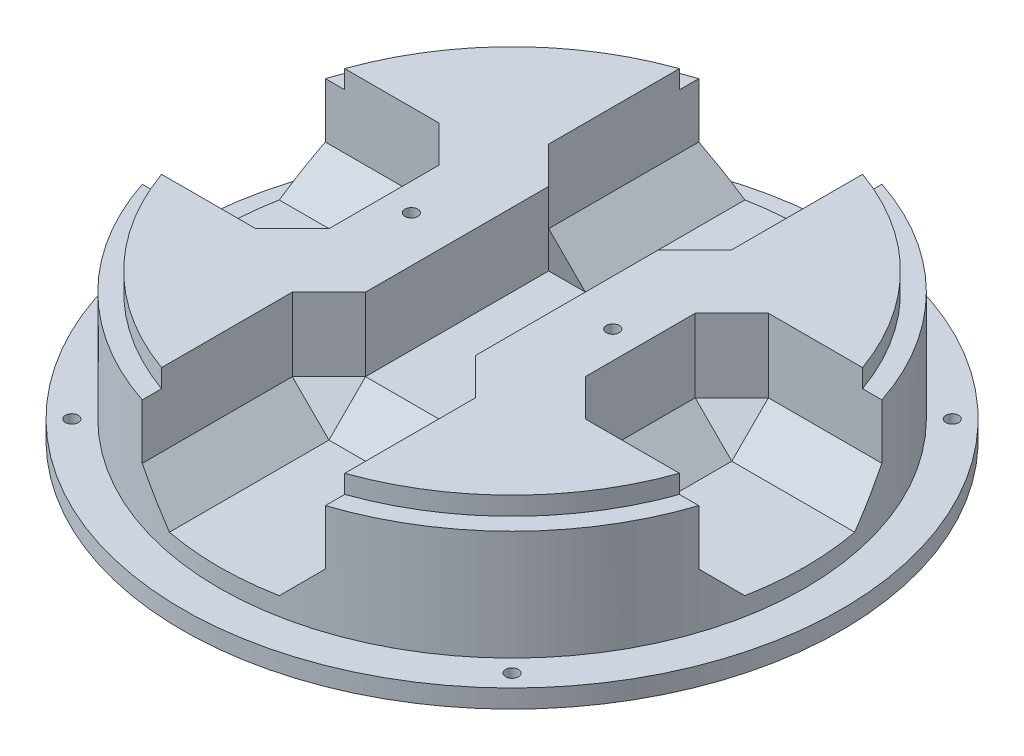
from build123d import *

# Parameters (mm, degrees)
SKETCH1_R                           = 80
BOSS_EXTRUDE1_DEPTH                 = 30
SKETCH2_R                           = 90
BOSS_EXTRUDE2_DEPTH                 = 5
SKETCH6_R                           = 75
BOSS_EXTRUDE3_DEPTH                 = 5
F_3_5_3_5_DIAMETER_HOLE1_D          = 3.5
F_3_5_3_5_DIAMETER_HOLE1_DEPTH      = 10
F_3_5_3_5_DIAMETER_HOLE1_TIP        = 1.051506083
SKETCH7_W                           = 50
SKETCH7_H                           = 110
CUT_EXTRUDE1_DEPTH                  = 30
CHAMFER1_SIZE                       = 10
SKETCH8_W                           = 30
SKETCH8_H                           = 50
CUT_EXTRUDE2_DEPTH                  = 20
F_3_5_3_5_DIAMETER_HOLE2_AT_2_COUNT = 2
F_3_5_3_5_DIAMETER_HOLE2_AT_2_PITCH = 85
F_3_5_3_5_DIAMETER_HOLE2_AT_3_COUNT = 2
F_3_5_3_5_DIAMETER_HOLE2_AT_3_PITCH = 85
F_3_5_3_5_DIAMETER_HOLE2_AT_4_COUNT = 2
F_3_5_3_5_DIAMETER_HOLE2_AT_4_PITCH = 85
F_3_5_3_5_DIAMETER_HOLE2_AT_5_COUNT = 2
F_3_5_3_5_DIAMETER_HOLE2_AT_5_PITCH = 85
SKETCH11_W                          = 80
SKETCH11_H                          = 50
CUT_EXTRUDE3_DEPTH                  = 30
CHAMFER2_SIZE                       = 10


with BuildPart() as part:
    # Sketch1 → Boss-Extrude1 (new body)
    with BuildSketch(Plane(origin=(0, 0, 0), x_dir=(1, 0, 0), z_dir=(0, 1, 0))):
        with Locations(Location((0, 0, 0), (0, 0, 270))):
            Circle(SKETCH1_R)
    extrude(amount=BOSS_EXTRUDE1_DEPTH)

    # Sketch2 → Boss-Extrude2 (add)
    with BuildSketch(Plane.XZ):
        with Locations(Location((0, 0, 0), (0, 0, 270))):
            Circle(SKETCH2_R)
    extrude(amount=BOSS_EXTRUDE2_DEPTH)

    # Sketch6 → Boss-Extrude3 (add)
    with BuildSketch(Plane(origin=(0, 30, 0), x_dir=(1, 0, 0), z_dir=(0, 1, 0))):
        with Locations(Location((0, 0, 0), (0, 0, 270))):
            Circle(SKETCH6_R)
    extrude(amount=BOSS_EXTRUDE3_DEPTH)

    # Ø3.5 (3.5) Diameter Hole1
    with Locations(Plane(origin=(-12.746034072, 35, -7.868896946), x_dir=(1, 0, 0), z_dir=(0, 1, 0))):
        with Locations((-14.753965928, -7.868896946), (40.246034072, -7.868896946)):
            Hole(F_3_5_3_5_DIAMETER_HOLE1_D / 2, depth=F_3_5_3_5_DIAMETER_HOLE1_DEPTH)
            with Locations((0, 0, -(F_3_5_3_5_DIAMETER_HOLE1_DEPTH + F_3_5_3_5_DIAMETER_HOLE1_TIP / 2))):  # 118° drill point
                Cone(0, F_3_5_3_5_DIAMETER_HOLE1_D / 2, F_3_5_3_5_DIAMETER_HOLE1_TIP, mode=Mode.SUBTRACT)

    # Sketch7 → Cut-Extrude1 (cut)
    with BuildSketch(Plane(origin=(0, 35, 0), x_dir=(1, 0, 0), z_dir=(0, 1, 0))):
        with Locations((0, 80)):
            Rectangle(SKETCH7_W, SKETCH7_H)
        with Locations((0, -80)):
            Rectangle(SKETCH7_W, SKETCH7_H)
    extrude(amount=-CUT_EXTRUDE1_DEPTH, mode=Mode.SUBTRACT)

    # Chamfer1
    chamfer1_edges = [part.edges().sort_by_distance(p)[0] for p in [
        (25, 5, -50.496710384),
        (-25, 5, -50.496710384),
        (-25, 20, -25),
        (0, 5, -25),
        (25, 20, -25),
        (25, 5, 50.496710384),
        (25, 20, 25),
        (-25, 5, 50.496710384),
        (0, 5, 25),
        (-25, 20, 25),
    ]]
    chamfer(chamfer1_edges, length=CHAMFER1_SIZE)

    # Sketch8 → Cut-Extrude2 (cut)
    with BuildSketch(Plane(origin=(0, 35, 0), x_dir=(1, 0, 0), z_dir=(0, 1, 0))):
        Rectangle(SKETCH8_W, SKETCH8_H)
    extrude(amount=-CUT_EXTRUDE2_DEPTH, mode=Mode.SUBTRACT)

    # Sketch9 → Ø3.5 (3.5) Diameter Hole2 (revolve, cut)
    with BuildSketch(Plane(origin=(0, 0, 0), x_dir=(0, 0, 1), z_dir=(1, 0, 0))):
        Polygon((0, 0), (0, 11.051506083), (1.75, 10), (1.75, 0), align=None)
    f_3_5_3_5_diameter_hole2 = revolve(axis=Axis((0, 6.35, 0), (0, -1, 0)), mode=Mode.SUBTRACT)

    # Ø3.5 (3.5) Diameter Hole2 at 2: Ø3.5 (3.5) Diameter Hole2 ×2
    with Locations(*[Vector(0.7071067811865478, 0, 0.7071067811865475) * (i * F_3_5_3_5_DIAMETER_HOLE2_AT_2_PITCH) for i in range(1, F_3_5_3_5_DIAMETER_HOLE2_AT_2_COUNT)]):
        add(f_3_5_3_5_diameter_hole2, mode=Mode.SUBTRACT)

    # Ø3.5 (3.5) Diameter Hole2 at 3: Ø3.5 (3.5) Diameter Hole2 ×2
    with Locations(*[Vector(-0.7071067811865477, 0, -0.7071067811865475) * (i * F_3_5_3_5_DIAMETER_HOLE2_AT_3_PITCH) for i in range(1, F_3_5_3_5_DIAMETER_HOLE2_AT_3_COUNT)]):
        add(f_3_5_3_5_diameter_hole2, mode=Mode.SUBTRACT)

    # Ø3.5 (3.5) Diameter Hole2 at 4: Ø3.5 (3.5) Diameter Hole2 ×2
    with Locations(*[Vector(-0.7071067811865476, 0, 0.7071067811865476) * (i * F_3_5_3_5_DIAMETER_HOLE2_AT_4_PITCH) for i in range(1, F_3_5_3_5_DIAMETER_HOLE2_AT_4_COUNT)]):
        add(f_3_5_3_5_diameter_hole2, mode=Mode.SUBTRACT)

    # Ø3.5 (3.5) Diameter Hole2 at 5: Ø3.5 (3.5) Diameter Hole2 ×2
    with Locations(*[Vector(0.7071067811865476, 0, -0.7071067811865476) * (i * F_3_5_3_5_DIAMETER_HOLE2_AT_5_PITCH) for i in range(1, F_3_5_3_5_DIAMETER_HOLE2_AT_5_COUNT)]):
        add(f_3_5_3_5_diameter_hole2, mode=Mode.SUBTRACT)

    # Sketch11 → Cut-Extrude3 (cut)
    with BuildSketch(Plane(origin=(0, 35, 0), x_dir=(1, 0, 0), z_dir=(0, 1, 0))):
        with Locations((75, 0)):
            Rectangle(SKETCH11_W, SKETCH11_H)
        with Locations((-75, 0)):
            Rectangle(SKETCH11_W, SKETCH11_H)
    extrude(amount=-CUT_EXTRUDE3_DEPTH, mode=Mode.SUBTRACT)

    # Chamfer2
    chamfer2_edges = [part.edges().sort_by_distance(p)[0] for p in [
        (55.496710384, 5, -25),
        (35, 20, -25),
        (55.496710384, 5, 25),
        (35, 5, 0),
        (35, 20, 25),
        (-55.496710384, 5, -25),
        (-55.496710384, 5, 25),
        (-35, 20, 25),
        (-35, 5, 0),
        (-35, 20, -25),
    ]]
    chamfer(chamfer2_edges, length=CHAMFER2_SIZE)


solid = part.part
